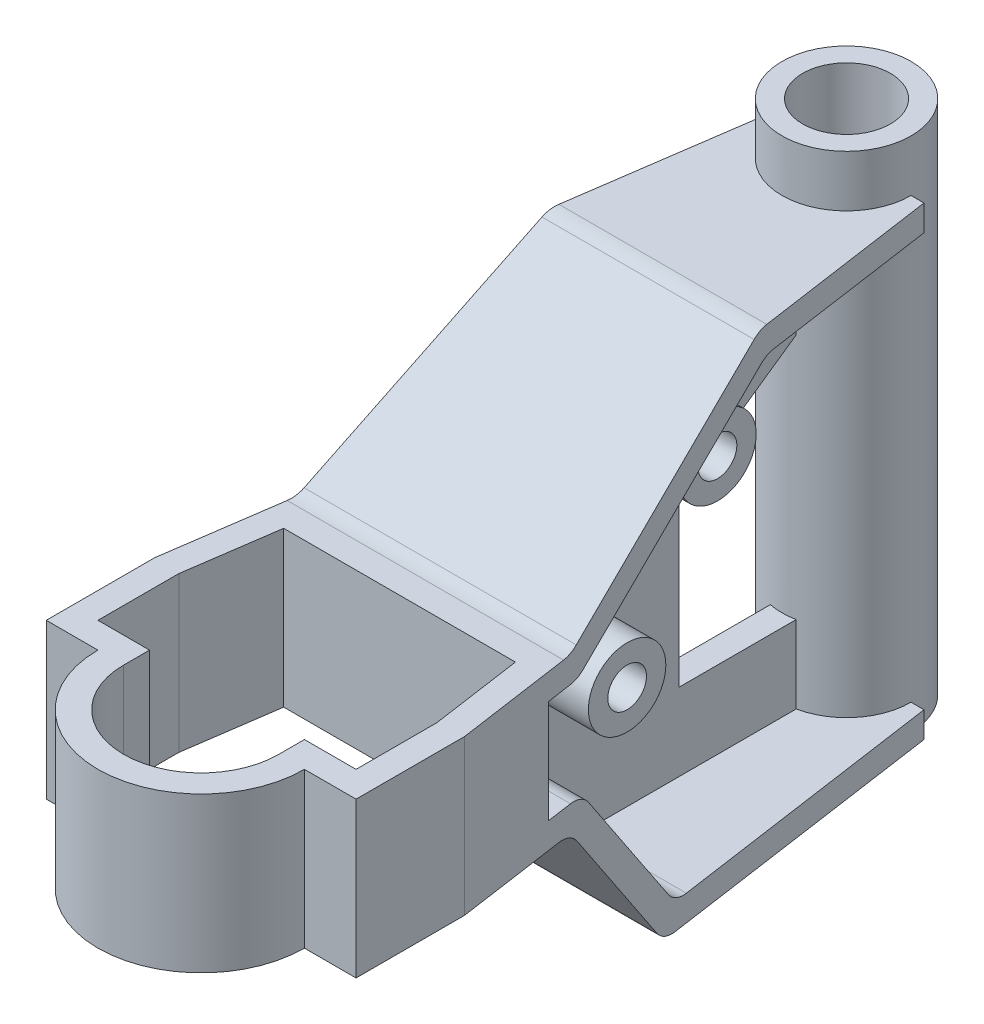
from build123d import *
from build123d.topology import SkipClean

# Parameters (mm, degrees)
BOSS_EXTRUDE1_DEPTH     = 60
CUT_EXTRUDE1_DEPTH      = 314.84709653
CUT_EXTRUDE2_REACH      = 290.725
CUT_EXTRUDE2_START      = 5
FILLET1_R               = 10
BOSS_EXTRUDE4_DEPTH     = 60
BOSS_EXTRUDE2_DEPTH     = 200
CUT_EXTRUDE3_DEPTH      = 306.982025616
CUT_EXTRUDE3_DEPTH_BACK = 306.982025616
SKETCH5_R               = 17
SKETCH6_R               = 15
BOSS_EXTRUDE3_DEPTH     = 20
CUT_EXTRUDE4_REACH      = 312.564
SKETCH7_R               = 7.5


with BuildPart() as part:
    # Sketch1 → Boss-Extrude1 (new body)
    with BuildSketch(Plane(origin=(0, 0, 0), x_dir=(0, 0, -1), z_dir=(1, 0, 0))):
        Polygon((0, 0), (0, 60), (90, 60), (175.688880405, 120), (250, 120), (250, 92.682857844), (180, 43.668330169), (180, -20), (250, -20), (250, -60), (132.012452293, -60), (90, 0), align=None)
    extrude(amount=BOSS_EXTRUDE1_DEPTH)

    # Sketch2 → Cut-Extrude1 (cut, through all)
    with BuildSketch(Plane(origin=(0, 120, 0), x_dir=(1, 0, 0), z_dir=(0, 1, 0))):
        Polygon((60, 42.034783703), (30, 250), (60, 250), align=None)
    extrude(amount=-CUT_EXTRUDE1_DEPTH, mode=Mode.SUBTRACT)

    # Cut-Extrude2: up to this plane
    cut_extrude2_end = Plane(origin=(60, -60, -42.034783703), z_dir=(-0.9897548850976273, 0, 0.1427769849288831))
    # Sketch4 → Cut-Extrude2 (cut, up to the surface)
    with BuildSketch(Plane(origin=(0, 0, 0), x_dir=(0, 0, -1), z_dir=(1, 0, 0)).offset(CUT_EXTRUDE2_START), mode=Mode.PRIVATE) as cut_extrude2_sk1:
        Polygon((80, 50), (80, 10), (95.205670506, 10), (137.218122798, -50), (250, -50), (250, 110), (178.841868293, 110), (93.152987889, 50), align=None)
    cut_extrude2_tool1 = split(extrude(cut_extrude2_sk1.sketch, amount=CUT_EXTRUDE2_REACH, mode=Mode.PRIVATE), bisect_by=cut_extrude2_end, keep=Keep.BOTH, mode=Mode.PRIVATE)
    add(cut_extrude2_tool1.solids().sort_by_distance((5, 26.655834, -179.495855))[0], mode=Mode.SUBTRACT)

    # Fillet1
    fillet1_edges = [part.edges().sort_by_distance(p)[0] for p in [
        (26.540391431, 60, -90),
        (20.359871299, 120, -175.688880405),
        (23.510140528, -60, -132.012452293),
        (26.540391431, 0, -90),
        (28.66491971, 10, -95.205670506),
        (25.634668807, -50, -137.218122798),
        (22.632454334, 110, -178.841868293),
        (28.812974465, 50, -93.152987889),
    ]]
    fillet(fillet1_edges, radius=FILLET1_R)

    # Sketch8 → Boss-Extrude4 (add)
    with BuildSketch(Plane(origin=(0, 60, 0), x_dir=(1, 0, 0), z_dir=(0, 1, 0))):
        with BuildLine():
            Line((0, 0), (0, -40))
            ThreePointArc((0, -40), (28.284271247, -28.284271247), (40, 0))
            Line((40, 0), (0, 0))
        make_face()
    extrude(amount=-BOSS_EXTRUDE4_DEPTH)

    # Sketch3 → Boss-Extrude2 (add)
    with BuildSketch(Plane.XZ.offset(60)):
        with BuildLine():
            Line((0, -275), (0, -225))
            ThreePointArc((0, -225), (25, -250), (0, -275))
        make_face()
    extrude(amount=-BOSS_EXTRUDE2_DEPTH)

    # Sketch5 → Cut-Extrude3 (cut, two sides: drawn at the far end of the back side and taken through both)
    with BuildSketch(Plane(origin=(0, 60, 0), x_dir=(1, 0, 0), z_dir=(0, 1, 0)).offset(-CUT_EXTRUDE3_DEPTH_BACK)):
        with Locations((0, 250)):
            Circle(SKETCH5_R)
        with BuildLine():
            Line((40, 10), (30, 10))
            Line((30, 10), (30, 0))
            ThreePointArc((30, 0), (21.213203436, -21.213203436), (0, -30))
            Line((0, -30), (0, 76.847012111))
            Line((0, 76.847012111), (44.874654082, 76.847012111))
            Line((44.874654082, 76.847012111), (50, 41.317223033))
            Line((50, 41.317223033), (50, 10))
            Line((50, 10), (40, 10))
        make_face()
    extrude(amount=CUT_EXTRUDE3_DEPTH + CUT_EXTRUDE3_DEPTH_BACK, mode=Mode.SUBTRACT)

    # Sketch6 → Boss-Extrude3 (add)
    with BuildSketch(Plane(origin=(5, 0, 0), x_dir=(0, 0, -1), z_dir=(1, 0, 0))):
        with Locations((175, 70)):
            Circle(SKETCH6_R)
        with Locations((140, 10)):
            Circle(SKETCH6_R)
    extrude(amount=BOSS_EXTRUDE3_DEPTH)

    # Sketch7 → Cut-Extrude4 (cut, up to next)
    with BuildSketch(Plane(origin=(25, 0, 0), x_dir=(0, 0, -1), z_dir=(1, 0, 0)), mode=Mode.PRIVATE) as cut_extrude4_sk1:
        with Locations((140, 10)):
            Circle(SKETCH7_R)
    cut_extrude4_tool1 = extrude(cut_extrude4_sk1.sketch, amount=-CUT_EXTRUDE4_REACH, mode=Mode.PRIVATE) & part.part
    # Sketch7 → Cut-Extrude4 (cut, up to next)
    with BuildSketch(Plane(origin=(25, 0, 0), x_dir=(0, 0, -1), z_dir=(1, 0, 0)), mode=Mode.PRIVATE) as cut_extrude4_sk2:
        with Locations((175, 70)):
            Circle(SKETCH7_R)
    cut_extrude4_tool2 = extrude(cut_extrude4_sk2.sketch, amount=-CUT_EXTRUDE4_REACH, mode=Mode.PRIVATE) & part.part
    add(cut_extrude4_tool1.solids().sort_by_distance((25, 10, -140))[0], mode=Mode.SUBTRACT)
    add(cut_extrude4_tool2.solids().sort_by_distance((25, 70, -175))[0], mode=Mode.SUBTRACT)

    # Mirror2: part across plane


with BuildPart() as part_1:
    with SkipClean():  # the faces are left unmerged after this step: merging them gives an invalid solid
        add(part.part)
        add(part.part.mirror(Plane.ZY))


solid = part_1.part
